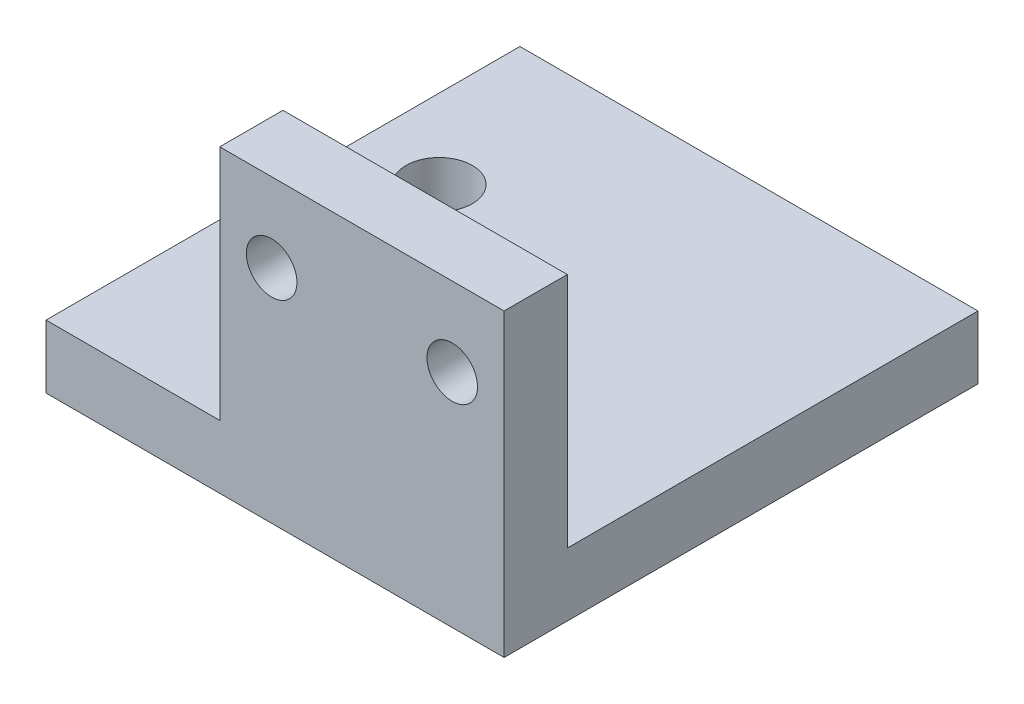
from build123d import *

# Parameters (mm, degrees)
SKETCH1_W                          = 18
SKETCH1_H                          = 19
BOSS_EXTRUDE1_DEPTH                = 2
SKETCH2_W                          = 29
SKETCH2_H                          = 4
BOSS_EXTRUDE2_DEPTH                = 30
M3_CLEARANCE_HOLE1_D               = 3.2
TAPPED_HOLE_FOR_M4X0_7_HELICOIL1_D = 4.2


with BuildPart() as part:
    # Sketch1 → Boss-Extrude1 (new, symmetric)
    with BuildSketch(Plane.XY):
        Rectangle(SKETCH1_W, SKETCH1_H)
    extrude(amount=BOSS_EXTRUDE1_DEPTH, both=True)

    # Sketch2 → Boss-Extrude2 (add)
    with BuildSketch(Plane(origin=(0, 0, 2), x_dir=(-1, 0, 0), z_dir=(0, 0, -1))):
        with Locations((5.5, -7.5)):
            Rectangle(SKETCH2_W, SKETCH2_H)
    extrude(amount=BOSS_EXTRUDE2_DEPTH)

    # M3 Clearance Hole1 (through all)
    with Locations(Plane.XY.offset(2)):
        with Locations((-5.715, 4.5028), (5.715, 4.5028)):
            Hole(M3_CLEARANCE_HOLE1_D / 2)

    # Tapped Hole for M4x0.7 Helicoil1 (through all)
    with Locations(Plane(origin=(0, -9.5, 0), x_dir=(-1, 0, 0), z_dir=(0, -1, 0))):
        with Locations((14.9858, 17.875)):
            Hole(TAPPED_HOLE_FOR_M4X0_7_HELICOIL1_D / 2)


solid = part.part
